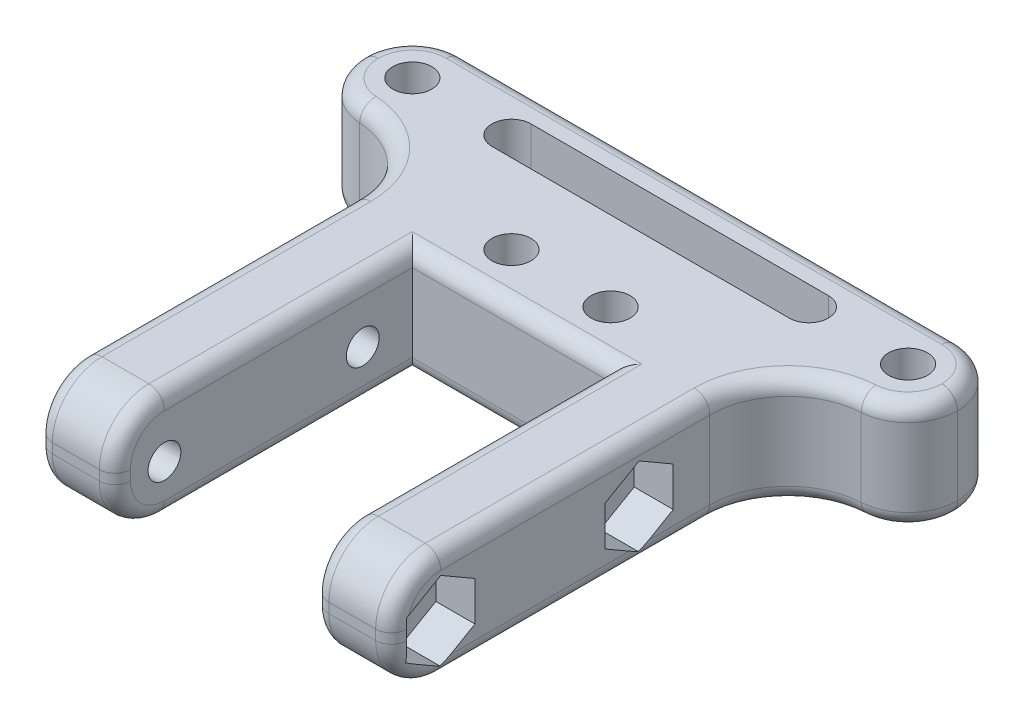
from build123d import *

# Parameters (mm, degrees)
SKETCH1_R               = 2.5
BOSS_EXTRUDE2_DEPTH     = 13.97
FILLET1_R               = 6.35
FILLET2_R               = 6.35
FILLET3_R               = 2
CUT_EXTRUDE1_REACH      = 86.605
SKETCH2_R               = 2.1
CUT_EXTRUDE4_DEPTH      = 12.7
CUT_EXTRUDE4_DEPTH_BACK = 5
FILLET4_R               = 2


with BuildPart() as part:
    # Sketch1 → Boss-Extrude2 (new body)
    with BuildSketch(Plane(origin=(0, 0, 0), x_dir=(1, 0, 0), z_dir=(0, 1, 0))):
        with BuildLine():
            Line((-6.35, 6.35), (69.85, 6.35))
            Line((69.85, 6.35), (69.85, -6.35))
            Line((69.85, -6.35), (64.45, -6.35))
            ThreePointArc((64.45, -6.35), (57.378932188, -9.278932188), (54.45, -16.35))
            Line((54.45, -16.35), (54.45, -57.15))
            Line((54.45, -57.15), (44.45, -57.15))
            Line((44.45, -57.15), (44.45, -19.05))
            Line((44.45, -19.05), (19.05, -19.05))
            Line((19.05, -19.05), (19.05, -57.15))
            Line((19.05, -57.15), (9.05, -57.15))
            Line((9.05, -57.15), (9.05, -16.35))
            ThreePointArc((9.05, -16.35), (6.121067812, -9.278932188), (-0.95, -6.35))
            Line((-0.95, -6.35), (-6.35, -6.35))
            Line((-6.35, -6.35), (-6.35, 6.35))
        make_face()
        with Locations(Location((0, 0, 0), (0, 0, 270))):
            Circle(SKETCH1_R, mode=Mode.SUBTRACT)
        with Locations(Location((63.5, 0, 0), (0, 0, 270))):
            Circle(SKETCH1_R, mode=Mode.SUBTRACT)
        with Locations(Location((38.1, -12.7, 0), (0, 0, 270))):
            Circle(SKETCH1_R, mode=Mode.SUBTRACT)
        with Locations(Location((25.4, -12.7, 0), (0, 0, 270))):
            Circle(SKETCH1_R, mode=Mode.SUBTRACT)
        with BuildLine():
            Line((12.7, 2.5), (50.8, 2.5))
            ThreePointArc((50.8, 2.5), (53.3, 0), (50.8, -2.5))
            Line((50.8, -2.5), (12.7, -2.5))
            ThreePointArc((12.7, -2.5), (10.2, 0), (12.7, 2.5))
        make_face(mode=Mode.SUBTRACT)
    extrude(amount=BOSS_EXTRUDE2_DEPTH)

    # Fillet1
    fillet1_edges = [part.edges().sort_by_distance(p)[0] for p in [
        (49.45, 0, 57.15),
        (14.05, 0, 57.15),
        (14.05, 13.97, 57.15),
        (49.45, 13.97, 57.15),
    ]]
    fillet(fillet1_edges, radius=FILLET1_R)

    # Fillet2
    fillet2_edges = [part.edges().sort_by_distance(p)[0] for p in [
        (69.85, 6.985, 6.35),
        (69.85, 6.985, -6.35),
        (-6.35, 6.985, -6.35),
        (-6.35, 6.985, 6.35),
    ]]
    fillet(fillet2_edges, radius=FILLET2_R)

    # Fillet3
    fillet3_edges = [part.edges().sort_by_distance(p)[0] for p in [
        (-4.490128061, 0, -4.490128061),
        (67.990128061, 0, -4.490128061),
        (68.11873346, 0, 4.385351629),
        (31.75, 13.97, -6.35),
        (-6.35, 13.97, 0.013811361),
        (6.323596, 13.97, 9.487434793),
        (-4.61873346, 13.97, 4.385351629),
        (-4.490128061, 13.97, -4.490128061),
        (67.990128061, 13.97, -4.490128061),
        (68.11873346, 13.97, 4.385351629),
        (9.05, 0, 33.575),
        (57.176404, 0, 9.487434793),
        (9.05, 13.97, 33.575),
        (57.176404, 13.97, 9.487434793),
        (54.45, 6.985, 57.15),
        (54.45, 0, 33.575),
        (54.45, 13.97, 33.575),
        (54.45, 12.110128061, 55.290128061),
        (54.45, 1.859871939, 55.290128061),
        (9.05, 6.985, 57.15),
        (9.05, 12.110128061, 55.290128061),
        (9.05, 1.859871939, 55.290128061),
        (69.85, 0, 0.013811361),
        (69.85, 13.97, 0.013811361),
        (6.323596, 0, 9.487434793),
        (-6.35, 0, 0.013811361),
        (31.75, 0, -6.35),
        (-4.61873346, 0, 4.385351629),
    ]]
    fillet(fillet3_edges, radius=FILLET3_R)

    # Cut-Extrude1: up to this face of the body (flat: up to its plane)
    cut_extrude1_end = Plane(part.part.faces().sort_by_distance((54.45, 6.985, 35.354800331))[0])
    # Sketch2 → Cut-Extrude1 (cut, up to the picked face)
    with BuildSketch(Plane.ZY.offset(-9.05), mode=Mode.PRIVATE) as cut_extrude1_sk1:
        with Locations((50.8, 6.35)):
            Circle(SKETCH2_R)
    cut_extrude1_tool1 = split(extrude(cut_extrude1_sk1.sketch, amount=-CUT_EXTRUDE1_REACH, mode=Mode.PRIVATE), bisect_by=cut_extrude1_end, keep=Keep.BOTH, mode=Mode.PRIVATE)
    # Sketch2 → Cut-Extrude1 (cut, up to the picked face)
    with BuildSketch(Plane.ZY.offset(-9.05), mode=Mode.PRIVATE) as cut_extrude1_sk2:
        with Locations((25.4, 6.35)):
            Circle(SKETCH2_R)
    cut_extrude1_tool2 = split(extrude(cut_extrude1_sk2.sketch, amount=-CUT_EXTRUDE1_REACH, mode=Mode.PRIVATE), bisect_by=cut_extrude1_end, keep=Keep.BOTH, mode=Mode.PRIVATE)
    add(cut_extrude1_tool1.solids().sort_by(Axis((9.05, 6.35, 50.8), (1, 0, 0)))[0], mode=Mode.SUBTRACT)
    add(cut_extrude1_tool2.solids().sort_by(Axis((9.05, 6.35, 25.4), (1, 0, 0)))[0], mode=Mode.SUBTRACT)

    # Sketch3 → Cut-Extrude4 (cut, two sides: drawn at the far end of the back side and taken through both)
    with BuildSketch(Plane(origin=(54.45, 0, 0), x_dir=(0, 0, -1), z_dir=(1, 0, 0)).offset(-CUT_EXTRUDE4_DEPTH_BACK)):
        Polygon((-25.4, 1.298185145), (-21.025, 3.824092572), (-21.025, 8.875907428), (-25.4, 11.401814855), (-29.775, 8.875907428), (-29.775, 3.824092572), align=None)
        Polygon((-50.8, 1.298185145), (-46.425, 3.824092572), (-46.425, 8.875907428), (-50.8, 11.401814855), (-55.175, 8.875907428), (-55.175, 3.824092572), align=None)
    extrude(amount=CUT_EXTRUDE4_DEPTH + CUT_EXTRUDE4_DEPTH_BACK, mode=Mode.SUBTRACT)

    # Fillet4
    fillet4_edges = [part.edges().sort_by_distance(p)[0] for p in [
        (44.45, 0, 34.925),
        (31.75, 0, 19.05),
        (31.75, 13.97, 19.05),
        (44.45, 13.97, 34.925),
        (44.45, 6.985, 57.15),
        (19.05, 0, 34.925),
        (44.45, 12.110128061, 55.290128061),
        (44.45, 1.859871939, 55.290128061),
        (19.05, 13.97, 34.925),
        (19.05, 6.985, 57.15),
        (19.05, 12.110128061, 55.290128061),
        (19.05, 1.859871939, 55.290128061),
    ]]
    fillet(fillet4_edges, radius=FILLET4_R)


solid = part.part
